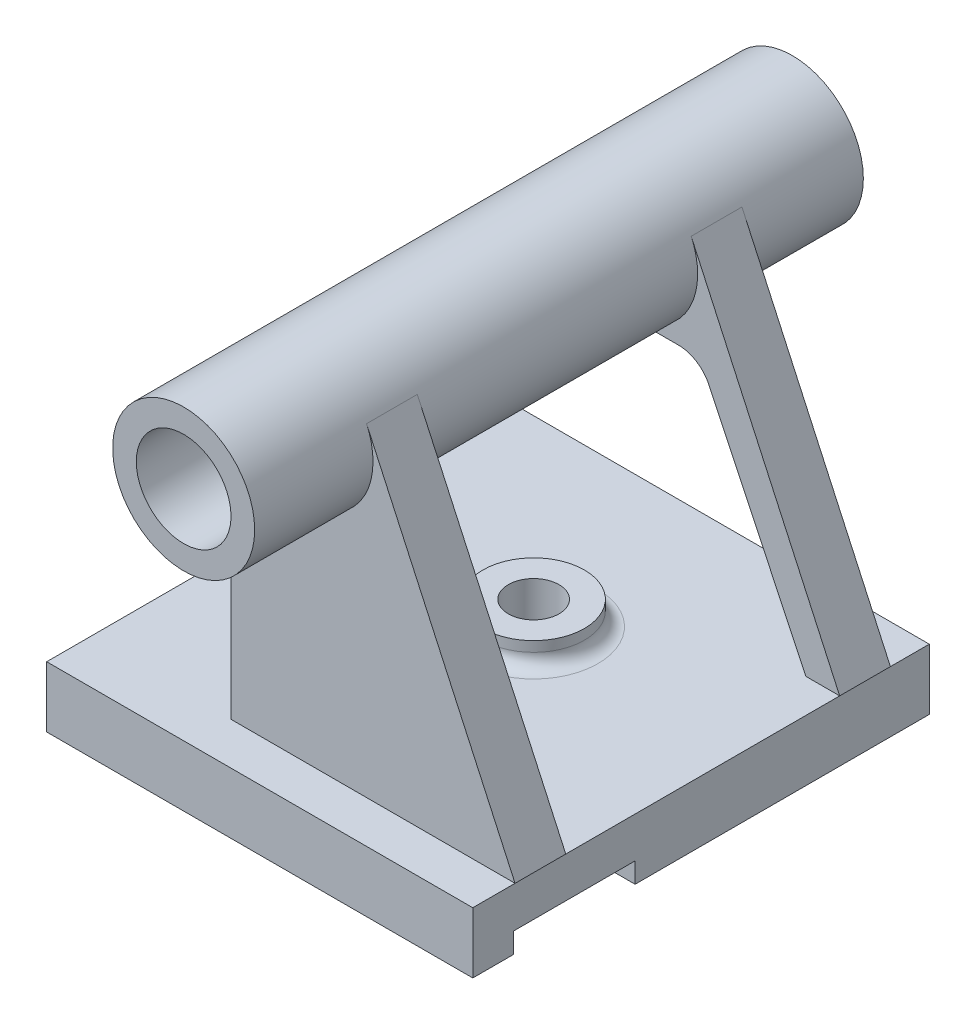
from build123d import *

# Parameters (mm, degrees)
SKETCH1_R           = 21
SKETCH1_R_2         = 14
BOSS_EXTRUDE1_DEPTH = 180
SKETCH3_W           = 126
SKETCH3_H           = 18
BOSS_EXTRUDE3_DEPTH = 67.5
SKETCH4_W           = 36
SKETCH4_H           = 6
CUT_EXTRUDE1_DEPTH  = 135
SKETCH5_R           = 15
SKETCH5_R_2         = 7.5
BOSS_EXTRUDE4_DEPTH = 7
FILLET1_R           = 4
BOSS_EXTRUDE5_START = -15
BOSS_EXTRUDE5_DEPTH = 15
BOSS_EXTRUDE6_START = 15
BOSS_EXTRUDE6_DEPTH = 15
CUT_EXTRUDE2_START  = -49
SKETCH9_R           = 7.5
CUT_EXTRUDE2_DEPTH  = 49


with BuildPart() as part:
    # Sketch1 → Boss-Extrude1 (new body)
    with BuildSketch(Plane.XY):
        with Locations(Location((0, 0, 0), (0, 0, 180))):
            Circle(SKETCH1_R)
        with Locations(Location((0, 0, 0), (0, 0, 180))):
            Circle(SKETCH1_R_2, mode=Mode.SUBTRACT)
    extrude(amount=BOSS_EXTRUDE1_DEPTH)



with BuildPart() as body_2:
    # Sketch3 → Boss-Extrude3 (new, symmetric)
    with BuildSketch(Plane(origin=(0, 0, 90), x_dir=(-1, 0, 0), z_dir=(0, 0, -1))):
        with Locations((0, -96)):
            Rectangle(SKETCH3_W, SKETCH3_H)
    extrude(amount=BOSS_EXTRUDE3_DEPTH, both=True)

    # Sketch4 → Cut-Extrude1 (cut)
    with BuildSketch(Plane(origin=(63, 0, 0), x_dir=(0, 0, -1), z_dir=(1, 0, 0))):
        with Locations((-127.5, -102)):
            Rectangle(SKETCH4_W, SKETCH4_H)
    extrude(amount=-CUT_EXTRUDE1_DEPTH, mode=Mode.SUBTRACT)

    # Sketch5 → Boss-Extrude4 (add)
    with BuildSketch(Plane(origin=(0, -87, 0), x_dir=(1, 0, 0), z_dir=(0, 1, 0))):
        with Locations(Location((0, -76.5, 0), (0, 0, 90))):
            Circle(SKETCH5_R)
        with Locations(Location((0, -76.5, 0), (0, 0, 270))):
            Circle(SKETCH5_R_2, mode=Mode.SUBTRACT)
    extrude(amount=BOSS_EXTRUDE4_DEPTH)

    # Fillet1
    fillet1_edges = [body_2.edges().sort_by_distance(p)[0] for p in [
        (0, -87, 91.5),
    ]]
    fillet(fillet1_edges, radius=FILLET1_R)


with BuildPart() as part_1:
    add(part.part)

    add(body_2.part)  # Boss-Extrude5 merges body 2
    # Sketch6 → Boss-Extrude5 (add)
    with BuildSketch(Plane.XY.offset(145).offset(BOSS_EXTRUDE5_START)):
        with BuildLine():
            Line((-21, 0), (-21, -87))
            Line((-21, -87), (63, -87))
            Line((63, -87), (19.088523196, 8.753758176))
            ThreePointArc((19.088523196, 8.753758176), (4.48001188, -20.51656632), (-21, 0))
        make_face()
    extrude(amount=BOSS_EXTRUDE5_DEPTH)

    # Sketch8 → Boss-Extrude6 (add)
    with BuildSketch(Plane(origin=(0, 0, 49), x_dir=(-1, 0, 0), z_dir=(0, 0, -1)).offset(BOSS_EXTRUDE6_START)):
        with BuildLine():
            Line((0, -21), (-15.31737287, -21))
            ThreePointArc((-15.31737287, -21), (-20.659650317, -22.546594078), (-24.349460831, -26.707985664))
            Line((-24.349460831, -26.707985664), (-53, -87))
            Line((-53, -87), (-63, -87))
            Line((-63, -87), (-19.088523196, 8.753758176))
            ThreePointArc((-19.088523196, 8.753758176), (-17.675249952, -11.339556391), (0, -21))
        make_face()
    extrude(amount=-BOSS_EXTRUDE6_DEPTH)

    # Sketch9 → Cut-Extrude2 (cut)
    with BuildSketch(Plane(origin=(0, -87, 0), x_dir=(1, 0, 0), z_dir=(0, 1, 0)).offset(CUT_EXTRUDE2_START)):
        with Locations(Location((0, -76.5, 0), (0, 0, 270))):
            Circle(SKETCH9_R)
    extrude(amount=CUT_EXTRUDE2_DEPTH, mode=Mode.SUBTRACT)


solid = part_1.part
